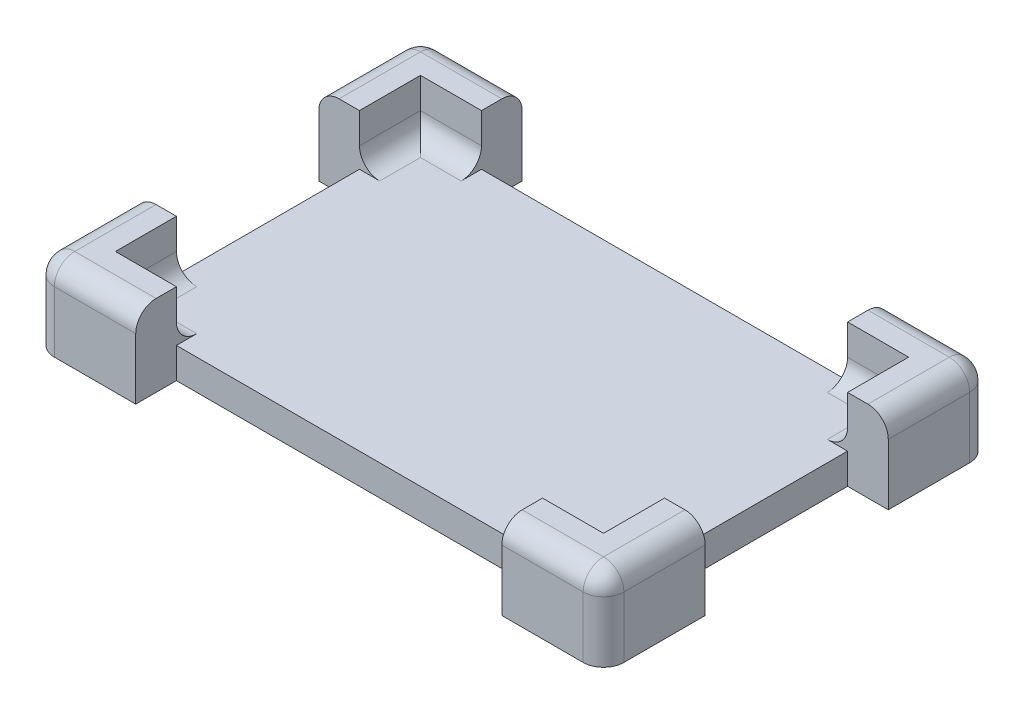
from build123d import *

# Parameters (mm, degrees)
SKETCH1_W            = 24
SKETCH1_H            = 15
BOSS_EXTRUDE1_DEPTH  = 0.75
BOSS_EXTRUDE2_START  = -1.5
BOSS_EXTRUDE2_DEPTH  = 4
MIRROR2_START        = -1.5
MIRROR2_COPY_1_DEPTH = 4
FILLET1_R            = 1


with BuildPart() as part:
    # Sketch1 → Boss-Extrude1 (new, symmetric)
    with BuildSketch(Plane(origin=(0, 0, 0), x_dir=(1, 0, 0), z_dir=(0, 1, 0))):
        Rectangle(SKETCH1_W, SKETCH1_H)
    extrude(amount=BOSS_EXTRUDE1_DEPTH, both=True)

    # Sketch2 → Boss-Extrude2 (add)
    with BuildSketch(Plane(origin=(0, 0.75, 0), x_dir=(1, 0, 0), z_dir=(0, 1, 0)).offset(BOSS_EXTRUDE2_START)):
        Polygon((-12, 4.5), (-14, 4.5), (-14, 9.5), (-9, 9.5), (-9, 7.5), (-12, 7.5), align=None)
    boss_extrude2 = extrude(amount=BOSS_EXTRUDE2_DEPTH)

    # Mirror1: Boss-Extrude2 across plane
    add(boss_extrude2.mirror(Plane(origin=(0, 0, 0), x_dir=(0, 0, 1), z_dir=(1, 0, 0))))

    # Mirror2: Boss-Extrude2 across plane
    add(boss_extrude2.mirror(Plane.XY))

    # Mirror2 copy 1 sketch → Mirror2 copy 1 (add)
    with BuildSketch(Plane(origin=(0, 0.75, 0), x_dir=(-1, 0, 0), z_dir=(0, 1, 0)).offset(MIRROR2_START)):
        Polygon((-12, 4.5), (-14, 4.5), (-14, 9.5), (-9, 9.5), (-9, 7.5), (-12, 7.5), align=None)
    extrude(amount=MIRROR2_COPY_1_DEPTH)

    # Fillet1
    fillet1_edges = [part.edges().sort_by_distance(p)[0] for p in [
        (12, 0.75, 6),
        (-10.5, 0.75, -7.5),
        (10.5, 0.75, -7.5),
        (-14, 1.25, -9.5),
        (-11.5, 3.25, -9.5),
        (-14, 3.25, -7),
        (12, 0.75, -6),
        (11.5, 3.25, -9.5),
        (14, 1.25, -9.5),
        (14, 3.25, -7),
        (-12, 0.75, -6),
        (-12, 0.75, 6),
        (-11.5, 3.25, 9.5),
        (-14, 1.25, 9.5),
        (-14, 3.25, 7),
        (10.5, 0.75, 7.5),
        (14, 1.25, 9.5),
        (11.5, 3.25, 9.5),
        (14, 3.25, 7),
        (-10.5, 0.75, 7.5),
    ]]
    fillet(fillet1_edges, radius=FILLET1_R)


solid = part.part
